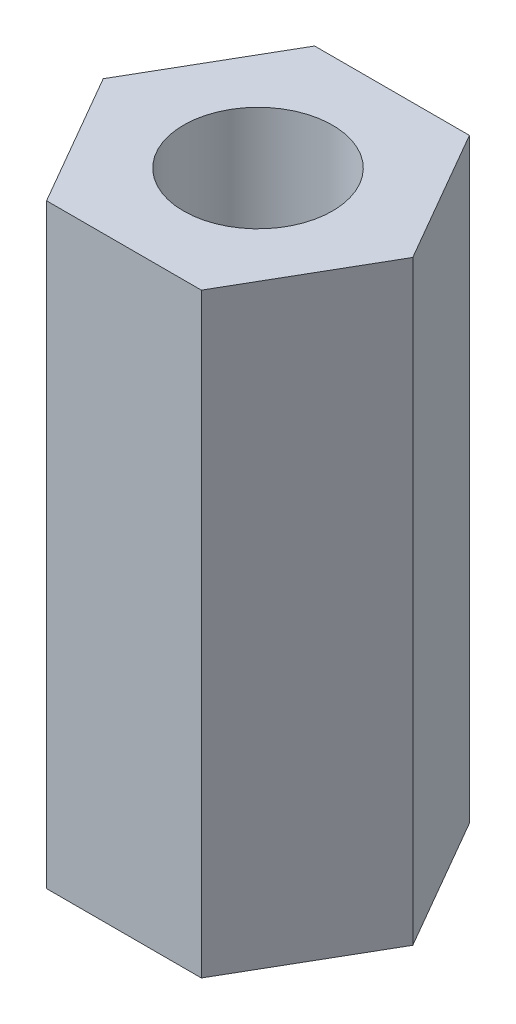
from build123d import *

# Parameters (mm, degrees)
SKETCH_1_R      = 1.25
EXTRUDE_1_DEPTH = 10


with BuildPart() as part:
    # 草图1 → 凸台-拉伸1 (new body)
    with BuildSketch(Plane(origin=(0, 0, 0), x_dir=(1, 0, 0), z_dir=(0, 1, 0))):
        Polygon((1.299038106, -2.25), (2.598076211, 0), (1.299038106, 2.25), (-1.299038106, 2.25), (-2.598076211, 0), (-1.299038106, -2.25), align=None)
        with Locations(Location((0, 0, 0), (0, 0, 270))):
            Circle(SKETCH_1_R, mode=Mode.SUBTRACT)
    extrude(amount=EXTRUDE_1_DEPTH)


solid = part.part
